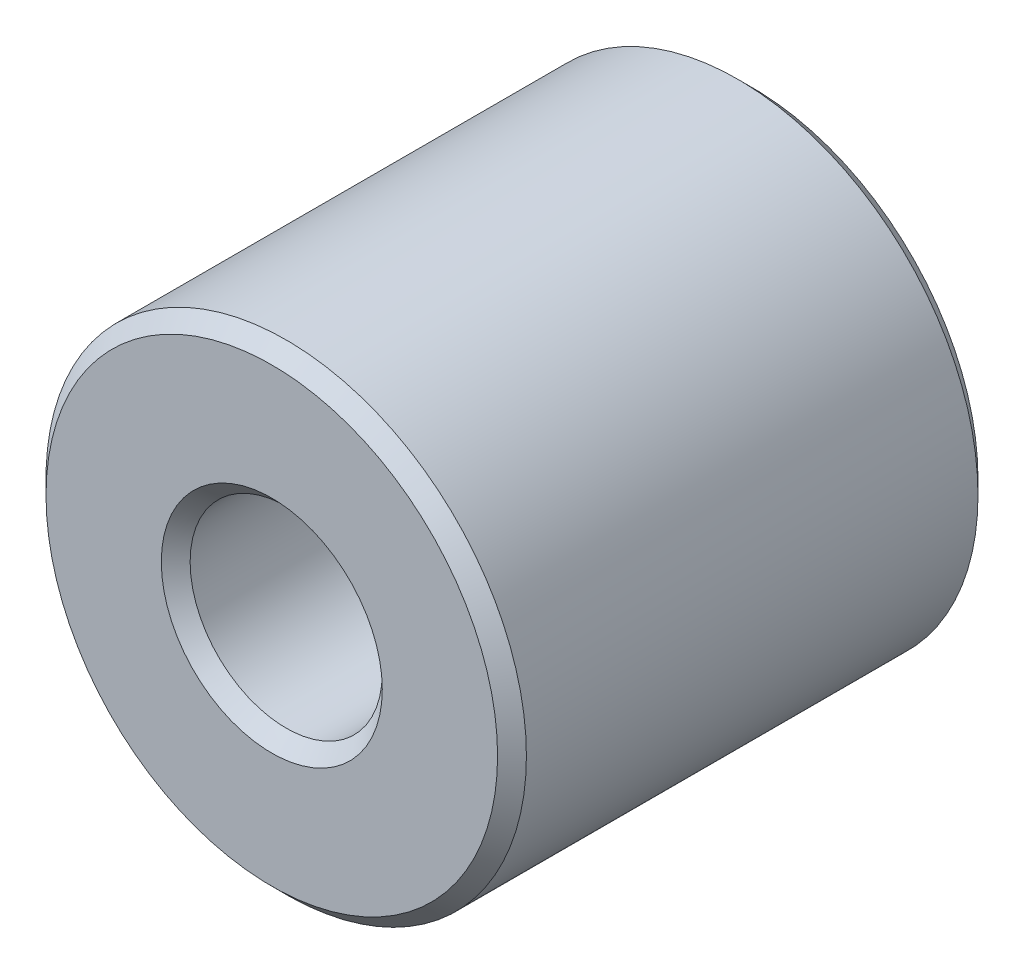
from build123d import *

# Parameters (mm, degrees)
BOSS_EXTRUDE1_DEPTH      = 4
BOSS_EXTRUDE1_DEPTH_BACK = 4
SKETCH3_R                = 4
SKETCH3_R_2              = 1.6
CHAMFER1_SIZE            = 0.24


with BuildPart() as part:
    # Sketch3 → Boss-Extrude1 (new, two sides: drawn at the far end of the back side and taken through both)
    with BuildSketch(Plane.XY.offset(-BOSS_EXTRUDE1_DEPTH_BACK)):
        Circle(SKETCH3_R)
        Circle(SKETCH3_R_2, mode=Mode.SUBTRACT)
    extrude(amount=BOSS_EXTRUDE1_DEPTH + BOSS_EXTRUDE1_DEPTH_BACK)

    # Chamfer1
    chamfer1_edges = [part.edges().sort_by_distance(p)[0] for p in [
        (-4, 0, -4),
        (-1.6, 0, -4),
        (-4, 0, 4),
        (-1.6, 0, 4),
    ]]
    chamfer(chamfer1_edges, length=CHAMFER1_SIZE)


solid = part.part
